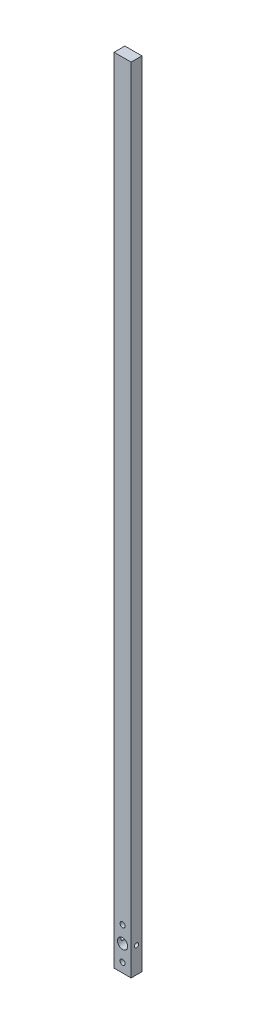
from build123d import *

# Parameters (mm, degrees)
SKETCH1_W                   = 10
SKETCH1_H                   = 465
SKETCH1_R                   = 1.5
SKETCH1_R_2                 = 3
BOSS_EXTRUDE1_DEPTH         = 6.35
TAP_DRILL_FOR_M3X0_5_TAP1_D = 2.5


with BuildPart() as part:
    # Sketch1 → Boss-Extrude1 (new body)
    with BuildSketch(Plane.XY):
        with Locations((0, 217.5)):
            Rectangle(SKETCH1_W, SKETCH1_H)
        with Locations((0, -9.5)):
            Circle(SKETCH1_R, mode=Mode.SUBTRACT)
        Circle(SKETCH1_R_2, mode=Mode.SUBTRACT)
        with Locations((0, 9.5)):
            Circle(SKETCH1_R, mode=Mode.SUBTRACT)
    extrude(amount=BOSS_EXTRUDE1_DEPTH)

    # Tap Drill for M3x0.5 Tap1 (through all)
    with Locations(Plane(origin=(5, 0, 0), x_dir=(0, 0, -1), z_dir=(1, 0, 0))):
        with Locations((-3.175, 0)):
            Hole(TAP_DRILL_FOR_M3X0_5_TAP1_D / 2)


solid = part.part
